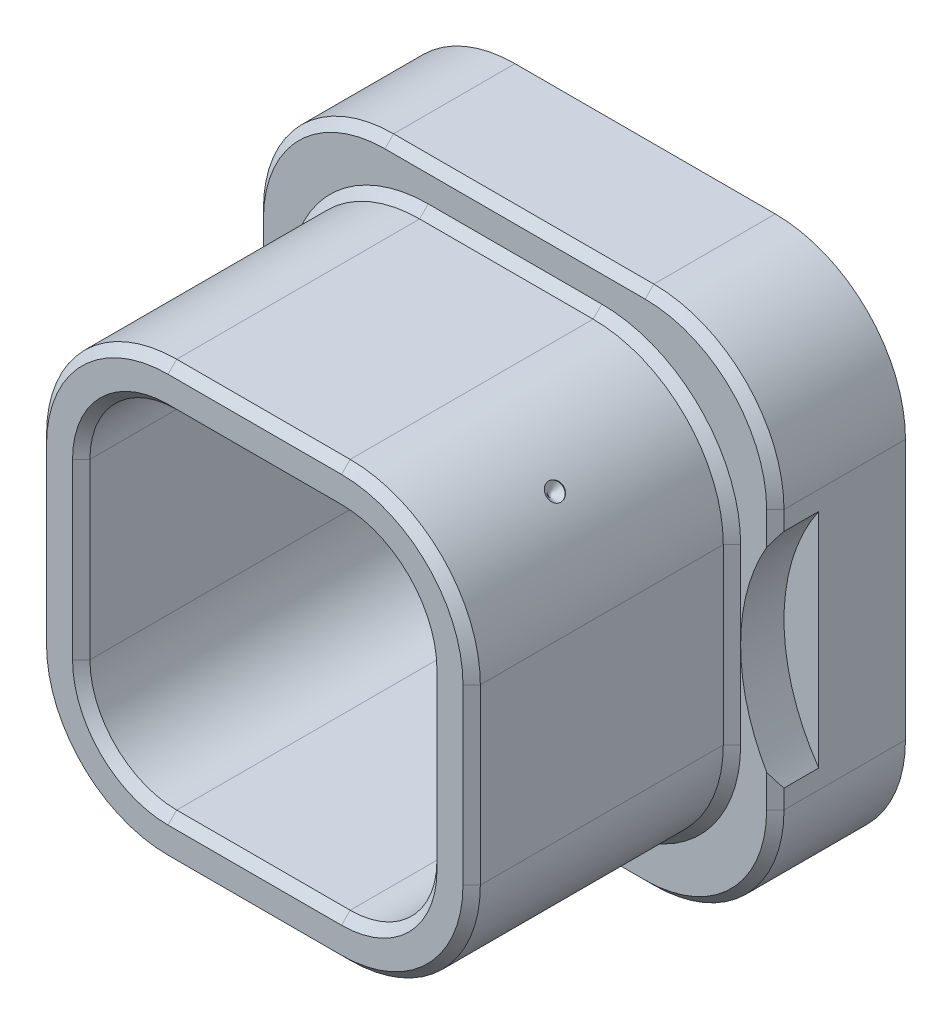
from build123d import *

# Parameters (mm, degrees)
SKIZZE1_W                            = 6
SKIZZE1_H                            = 6
AUFSATZ_LINEAR_AUSTRAGEN1_DEPTH      = 1.5
SKIZZE2_W                            = 5
SKIZZE2_H                            = 5
AUFSATZ_LINEAR_AUSTRAGEN2_DEPTH      = 3
SKIZZE3_W                            = 4
SKIZZE3_H                            = 4
SCHNITT_LINEAR_AUSTRAGEN1_DEPTH      = 3.5
VERRUNDUNG1_R                        = 1
VERRUNDUNG2_R                        = 1.5
VERRUNDUNG3_R                        = 1.5
FASE1_SIZE                           = 0.1
F_0_2_0_2_DURCHMESSER_BOHRUNG5_D     = 0.2
F_0_2_0_2_DURCHMESSER_BOHRUNG5_DEPTH = 0.01
F_0_2_0_2_DURCHMESSER_BOHRUNG5_TIP   = 0.1
SKIZZE7_R                            = 2.25
SCHNITT_LINEAR_AUSTRAGEN2_DEPTH      = 0.5


with BuildPart() as part:
    # Skizze1 → Aufsatz-Linear austragen1 (new body)
    with BuildSketch(Plane.XY):
        Rectangle(SKIZZE1_W, SKIZZE1_H)
    extrude(amount=-AUFSATZ_LINEAR_AUSTRAGEN1_DEPTH)

    # Skizze2 → Aufsatz-Linear austragen2 (add)
    with BuildSketch(Plane(origin=(0, 0, 0), x_dir=(-1, 0, 0), z_dir=(0, 0, -1))):
        Rectangle(SKIZZE2_W, SKIZZE2_H)
    extrude(amount=-AUFSATZ_LINEAR_AUSTRAGEN2_DEPTH)

    # Skizze3 → Schnitt-Linear austragen1 (cut)
    with BuildSketch(Plane.XY.offset(3)):
        Rectangle(SKIZZE3_W, SKIZZE3_H)
    extrude(amount=-SCHNITT_LINEAR_AUSTRAGEN1_DEPTH, mode=Mode.SUBTRACT)

    # Verrundung1
    verrundung1_edges = [part.edges().sort_by_distance(p)[0] for p in [
        (2, 2, 1.25),
        (2, -2, 1.25),
        (-2, -2, 1.25),
        (-2, 2, 1.25),
    ]]
    fillet(verrundung1_edges, radius=VERRUNDUNG1_R)

    # Verrundung2
    verrundung2_edges = [part.edges().sort_by_distance(p)[0] for p in [
        (-2.5, 2.5, 1.5),
        (-2.5, -2.5, 1.5),
        (2.5, -2.5, 1.5),
        (2.5, 2.5, 1.5),
    ]]
    fillet(verrundung2_edges, radius=VERRUNDUNG2_R)

    # Verrundung3
    verrundung3_edges = [part.edges().sort_by_distance(p)[0] for p in [
        (3, -3, -0.75),
        (-3, -3, -0.75),
        (-3, 3, -0.75),
        (3, 3, -0.75),
    ]]
    fillet(verrundung3_edges, radius=VERRUNDUNG3_R)

    # Fase1
    fase1_edges = [part.edges().sort_by_distance(p)[0] for p in [
        (0, -2, 3),
        (-2, 0, 3),
        (2, 0, 3),
        (0, 2, 3),
        (-1.707106781, -1.707106781, 3),
        (1.707106781, -1.707106781, 3),
        (1.707106781, 1.707106781, 3),
        (-1.707106781, 1.707106781, 3),
        (0, -2.5, 0),
        (0, -2.5, 3),
        (-2.5, 0, 0),
        (-2.5, 0, 3),
        (2.5, 0, 3),
        (0, 2.5, 3),
        (-2.060660172, 2.060660172, 3),
        (2.060660172, 2.060660172, 3),
        (2.060660172, -2.060660172, 3),
        (-2.060660172, -2.060660172, 3),
        (2.5, 0, 0),
        (0, 2.5, 0),
        (-2.060660172, -2.060660172, 0),
        (2.060660172, -2.060660172, 0),
        (2.060660172, 2.060660172, 0),
        (-2.060660172, 2.060660172, 0),
        (-3, 0, 0),
        (3, 0, 0),
        (0, 3, 0),
        (0, -3, 0),
        (-2.560660172, 2.560660172, 0),
        (2.560660172, 2.560660172, 0),
        (2.560660172, -2.560660172, 0),
        (-2.560660172, -2.560660172, 0),
    ]]
    chamfer(fase1_edges, length=FASE1_SIZE)

    # Ø0.2 (0.2) Durchmesser Bohrung5
    with Locations(Plane(origin=(2.060660172, 2.060660172, 0), x_dir=(0.7071067811865475, -0.7071067811865477, 0), z_dir=(0.7071067811865477, 0.7071067811865475, 0))):
        with Locations((0, -1.6)):
            Hole(F_0_2_0_2_DURCHMESSER_BOHRUNG5_D / 2, depth=F_0_2_0_2_DURCHMESSER_BOHRUNG5_DEPTH)
            with Locations((0, 0, -(F_0_2_0_2_DURCHMESSER_BOHRUNG5_DEPTH + F_0_2_0_2_DURCHMESSER_BOHRUNG5_TIP / 2))):  # 90° drill point
                Cone(0, F_0_2_0_2_DURCHMESSER_BOHRUNG5_D / 2, F_0_2_0_2_DURCHMESSER_BOHRUNG5_TIP, mode=Mode.SUBTRACT)

    # Skizze7 → Schnitt-Linear austragen2 (cut)
    with BuildSketch(Plane.XY):
        with Locations((-4.85, 0)):
            Circle(SKIZZE7_R)
        with Locations((4.85, 0)):
            Circle(SKIZZE7_R)
    extrude(amount=-SCHNITT_LINEAR_AUSTRAGEN2_DEPTH, mode=Mode.SUBTRACT)


solid = part.part
